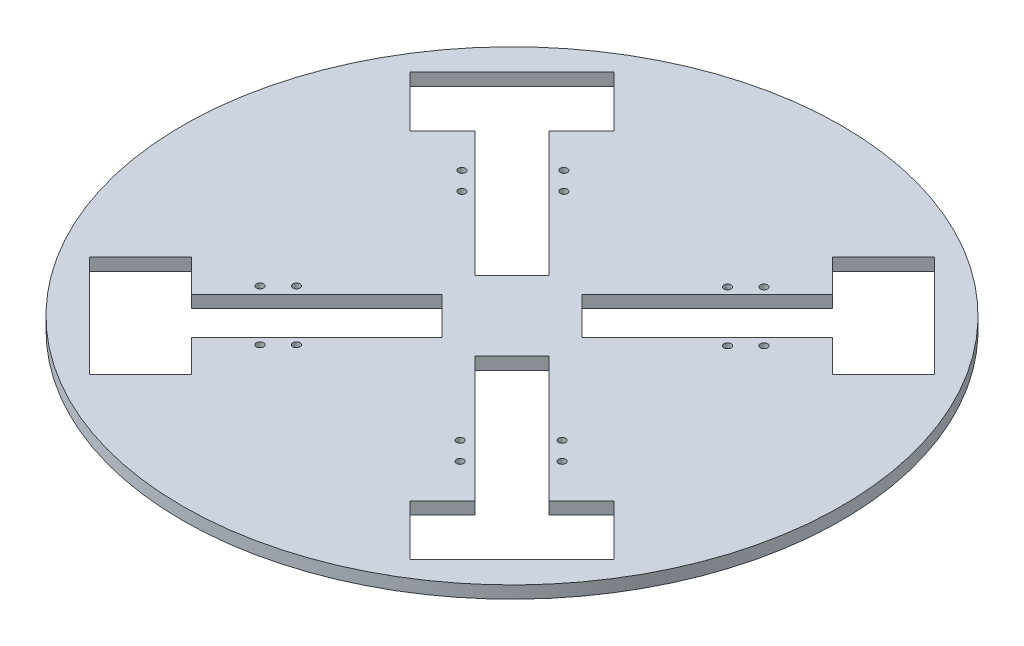
from build123d import *

# Parameters (mm, degrees)
SKETCH1_R           = 160
BOSS_EXTRUDE1_DEPTH = 6
CUT_EXTRUDE1_DEPTH  = 368.744476505
CUT_EXTRUDE2_DEPTH  = 368.744476505
SKETCH7_R           = 1.75
CUT_EXTRUDE3_DEPTH  = 368.744476505


with BuildPart() as part:
    # Sketch1 → Boss-Extrude1 (new body)
    with BuildSketch(Plane(origin=(0, 0, 0), x_dir=(1, 0, 0), z_dir=(0, 1, 0))):
        with Locations(Location((-100, 100, 0), (0, 0, 270))):
            Circle(SKETCH1_R)
    extrude(amount=BOSS_EXTRUDE1_DEPTH)

    # Sketch3 → Cut-Extrude1 (cut, through all)
    with BuildSketch(Plane.XZ):
        Polygon((-22.218254069, -227.279220614), (-46.966991411, -202.530483272), (2.530483272, -153.033008589), (27.279220614, -177.781745931), align=None)
        Polygon((2.530483272, -46.966991411), (27.279220614, -22.218254069), (-22.218254069, 27.279220614), (-46.966991411, 2.530483272), align=None)
        Polygon((-153.033008589, 2.530483272), (-177.781745931, 27.279220614), (-227.279220614, -22.218254069), (-202.530483272, -46.966991411), align=None)
        Polygon((-177.781745931, -227.279220614), (-153.033008589, -202.530483272), (-202.530483272, -153.033008589), (-227.279220614, -177.781745931), align=None)
    extrude(amount=-CUT_EXTRUDE1_DEPTH, mode=Mode.SUBTRACT)

    # Sketch4 → Cut-Extrude2 (cut, through all)
    with BuildSketch(Plane.XZ):
        Polygon((-31.23386553, -186.797357391), (-13.202642609, -168.76613447), (-74.013825791, -107.954951288), (-92.045048712, -125.986174209), align=None)
        Polygon((-125.986174209, -107.954951288), (-186.797357391, -168.76613447), (-168.76613447, -186.797357391), (-107.954951288, -125.986174209), align=None)
        Polygon((-107.954951288, -74.013825791), (-168.76613447, -13.202642609), (-186.797357391, -31.23386553), (-125.986174209, -92.045048712), align=None)
        Polygon((-74.013825791, -92.045048712), (-13.202642609, -31.23386553), (-31.23386553, -13.202642609), (-92.045048712, -74.013825791), align=None)
    extrude(amount=-CUT_EXTRUDE2_DEPTH, mode=Mode.SUBTRACT)

    # Sketch7 → Cut-Extrude3 (cut, through all)
    with BuildSketch(Plane.XZ):
        with Locations(Location((-149.002499936, -26.673026791, 0), (0, 0, 270))):
            Circle(SKETCH7_R)
        with Locations(Location((-148.578235868, -173.751237278, 0), (0, 0, 270))):
            Circle(SKETCH7_R)
        with Locations(Location((-140.163665171, -35.511861556, 0), (0, 0, 270))):
            Circle(SKETCH7_R)
        with Locations(Location((-164.912402513, -60.260598897, 0), (0, 0, 270))):
            Circle(SKETCH7_R)
        with Locations(Location((-173.751237278, -51.421764132, 0), (0, 0, 270))):
            Circle(SKETCH7_R)
        with Locations(Location((-173.326973209, -149.002499936, 0), (0, 0, 270))):
            Circle(SKETCH7_R)
        with Locations(Location((-164.488138444, -140.163665171, 0), (0, 0, 270))):
            Circle(SKETCH7_R)
        with Locations(Location((-139.739401103, -164.912402513, 0), (0, 0, 270))):
            Circle(SKETCH7_R)
        with Locations(Location((-26.673026791, -50.997500064, 0), (0, 0, 270))):
            Circle(SKETCH7_R)
        with Locations(Location((-35.511861556, -59.836334829, 0), (0, 0, 270))):
            Circle(SKETCH7_R)
        with Locations(Location((-60.260598897, -35.087597487, 0), (0, 0, 270))):
            Circle(SKETCH7_R)
        with Locations(Location((-51.421764132, -26.248762722, 0), (0, 0, 270))):
            Circle(SKETCH7_R)
        with Locations(Location((-50.997500064, -173.326973209, 0), (0, 0, 270))):
            Circle(SKETCH7_R)
        with Locations(Location((-59.836334829, -164.488138444, 0), (0, 0, 270))):
            Circle(SKETCH7_R)
        with Locations(Location((-35.087597487, -139.739401103, 0), (0, 0, 270))):
            Circle(SKETCH7_R)
        with Locations(Location((-26.248762722, -148.578235868, 0), (0, 0, 270))):
            Circle(SKETCH7_R)
    extrude(amount=-CUT_EXTRUDE3_DEPTH, mode=Mode.SUBTRACT)


solid = part.part
